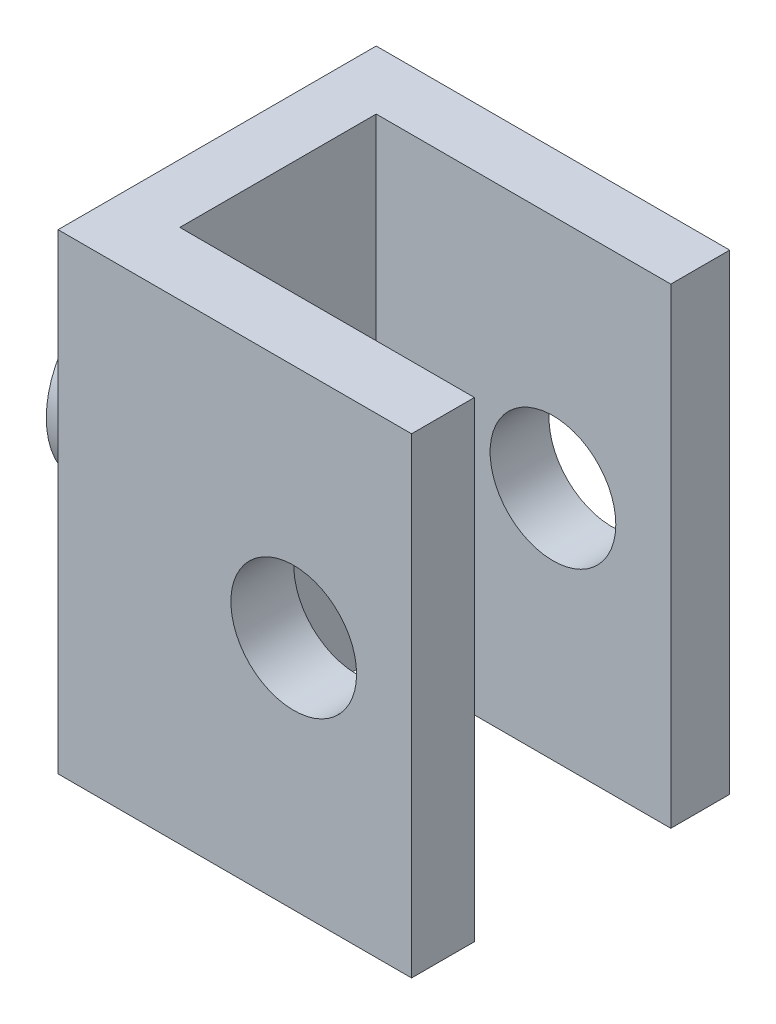
from build123d import *

# Parameters (mm, degrees)
SPRING_FRONT_CABLE_CLEVIS_1_SKETCH_W  = 1.5
SPRING_FRONT_CABLE_CLEVIS_1_SKETCH_H  = 12
SPRING_FRONT_CABLE_CLEVIS_1_DEPTH     = 8.1
SPRING_FRONT_CLEVIS_1_LOWER_SKETCH_W  = 7.6
SPRING_FRONT_CLEVIS_1_LOWER_SKETCH_H  = 12
SPRING_FRONT_CLEVIS_1_LOWER_DEPTH     = 1.5
SPRING_FRONT_CLEVIS_1_UPPER_SKETCH_W  = 7.6
SPRING_FRONT_CLEVIS_1_UPPER_SKETCH_H  = 12
SPRING_FRONT_CLEVIS_1_UPPER_DEPTH     = 1.6
FRONT_CLEVIS_SWAGE_HOUSING_1_SKETCH_R = 2.4
FRONT_CLEVIS_SWAGE_HOUSING_1_DEPTH    = 2.1
FRONT_CLEVIS_SWAGE_BORE_1_SKETCH_R    = 0.75
FRONT_CLEVIS_SWAGE_BORE_1_DEPTH       = 2.15
FRONT_CLEVIS_PIN_BORE_1_SKETCH_R      = 1.6
FRONT_CLEVIS_PIN_BORE_1_DEPTH         = 8.3


with BuildPart() as part:
    # Spring Front Cable Clevis 1 sketch → Spring Front Cable Clevis 1 (new body)
    with BuildSketch(Plane.XY.offset(11)):
        with Locations((-41.541651246, -12)):
            Rectangle(SPRING_FRONT_CABLE_CLEVIS_1_SKETCH_W, SPRING_FRONT_CABLE_CLEVIS_1_SKETCH_H)
    extrude(amount=SPRING_FRONT_CABLE_CLEVIS_1_DEPTH)

    # Spring Front Clevis 1 Lower sketch → Spring Front Clevis 1 Lower (add)
    with BuildSketch(Plane.XY.offset(11)):
        with Locations((-37.091651246, -12)):
            Rectangle(SPRING_FRONT_CLEVIS_1_LOWER_SKETCH_W, SPRING_FRONT_CLEVIS_1_LOWER_SKETCH_H)
    extrude(amount=SPRING_FRONT_CLEVIS_1_LOWER_DEPTH)

    # Spring Front Clevis 1 Upper sketch → Spring Front Clevis 1 Upper (add)
    with BuildSketch(Plane.XY.offset(17.5)):
        with Locations((-37.091651246, -12)):
            Rectangle(SPRING_FRONT_CLEVIS_1_UPPER_SKETCH_W, SPRING_FRONT_CLEVIS_1_UPPER_SKETCH_H)
    extrude(amount=SPRING_FRONT_CLEVIS_1_UPPER_DEPTH)

    # Front Clevis Swage Housing 1 sketch → Front Clevis Swage Housing 1 (add)
    with BuildSketch(Plane(origin=(-44.291651246, 0, 0), x_dir=(0, 0, -1), z_dir=(1, 0, 0))):
        with Locations((-15, -12)):
            Circle(FRONT_CLEVIS_SWAGE_HOUSING_1_SKETCH_R)
    extrude(amount=FRONT_CLEVIS_SWAGE_HOUSING_1_DEPTH)

    # Front Clevis Swage Bore 1 sketch → Front Clevis Swage Bore 1 (cut)
    with BuildSketch(Plane(origin=(-44.391651246, 0, 0), x_dir=(0, 0, -1), z_dir=(1, 0, 0))):
        with Locations((-15, -12)):
            Circle(FRONT_CLEVIS_SWAGE_BORE_1_SKETCH_R)
    extrude(amount=FRONT_CLEVIS_SWAGE_BORE_1_DEPTH, mode=Mode.SUBTRACT)

    # Front Clevis Pin Bore 1 sketch → Front Clevis Pin Bore 1 (cut)
    with BuildSketch(Plane.XY.offset(10.9)):
        with Locations((-36.291651246, -12)):
            Circle(FRONT_CLEVIS_PIN_BORE_1_SKETCH_R)
    extrude(amount=FRONT_CLEVIS_PIN_BORE_1_DEPTH, mode=Mode.SUBTRACT)


solid = part.part
